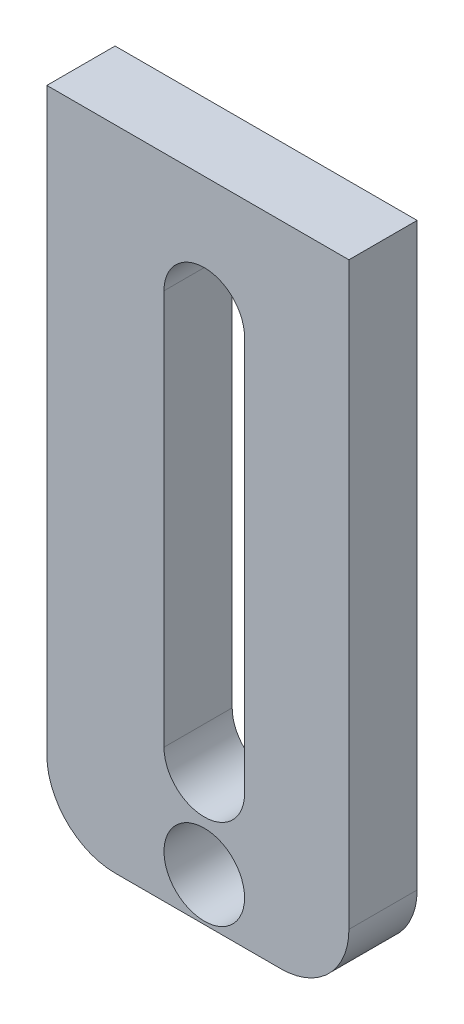
from build123d import *

# Parameters (mm, degrees)
SKETCH1_R           = 3
BOSS_EXTRUDE1_DEPTH = 5.08


with BuildPart() as part:
    # Sketch1 → Boss-Extrude1 (new body)
    with BuildSketch(Plane.XY):
        with BuildLine():
            Line((-132.737233389, 74.11925206), (-132.737233389, 79.19925206))
            Line((-132.737233389, 79.19925206), (-155.230857378, 79.19925206))
            Line((-155.230857378, 79.19925206), (-155.230857378, 74.11925206))
            Line((-155.230857378, 74.11925206), (-155.230857378, 36.01925206))
            ThreePointArc((-155.230857378, 36.01925206), (-153.742959826, 32.427149612), (-150.150857378, 30.93925206))
            Line((-150.150857378, 30.93925206), (-137.817233389, 30.93925206))
            ThreePointArc((-137.817233389, 30.93925206), (-134.22513094, 32.427149612), (-132.737233389, 36.01925206))
            Line((-132.737233389, 36.01925206), (-132.737233389, 74.11925206))
        make_face()
        with Locations((-143.509134839, 34.161720172)):
            Circle(SKETCH1_R, mode=Mode.SUBTRACT)
        with BuildLine():
            ThreePointArc((-146.509134839, 70.311824491), (-143.509134839, 73.311824491), (-140.509134839, 70.311824491))
            Line((-140.509134839, 70.311824491), (-140.509134839, 40.878834509))
            ThreePointArc((-140.509134839, 40.878834509), (-143.509134839, 37.878834509), (-146.509134839, 40.878834509))
            Line((-146.509134839, 40.878834509), (-146.509134839, 70.311824491))
        make_face(mode=Mode.SUBTRACT)
    extrude(amount=BOSS_EXTRUDE1_DEPTH)


solid = part.part
